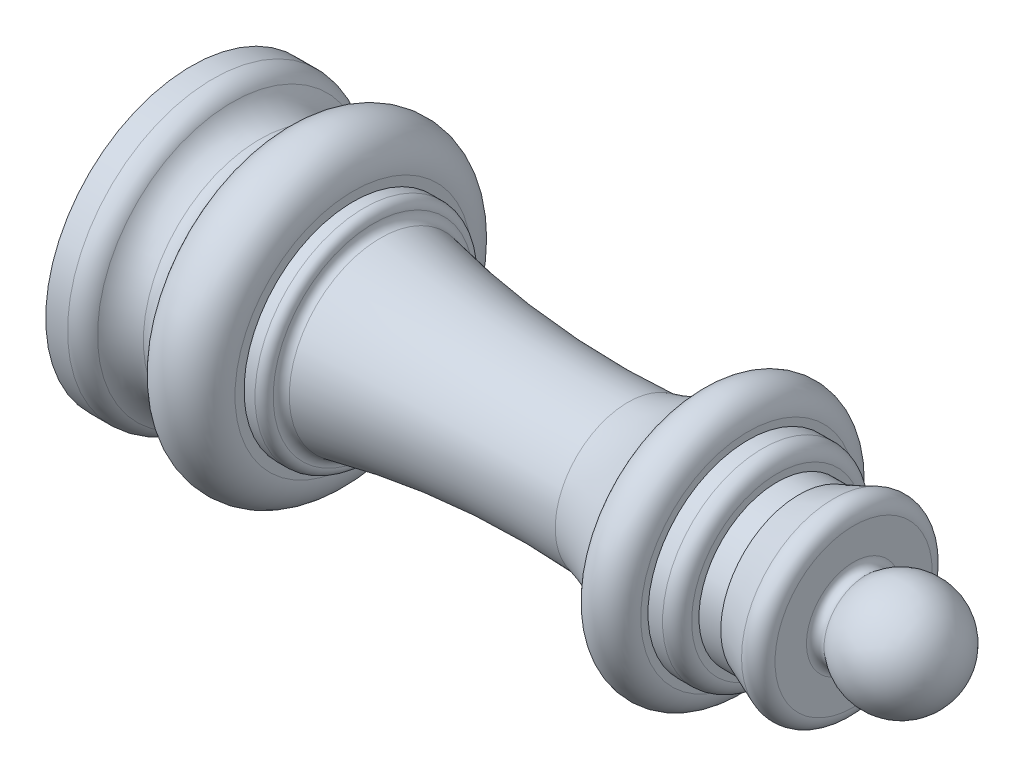
from build123d import *

# Parameters (mm, degrees)
FILLET_1_R = 2


with BuildPart() as part:
    # 草圖1 → 旋轉1 (revolve)
    with BuildSketch(Plane.XY):
        with BuildLine():
            Line((-14.008781327, 6.473278017), (-14.008781327, 13.75))
            Line((-14.008781327, 13.75), (-21.508781327, 10.75))
            Line((-21.508781327, 10.75), (-24.508781327, 10.75))
            Line((-24.508781327, 10.75), (-24.508781327, 13.75))
            Line((-24.508781327, 13.75), (-28.508781327, 13.75))
            Line((-28.508781327, 13.75), (-28.508781327, 14.75))
            ThreePointArc((-28.508781327, 14.75), (-32.125077777, 18), (-35.5, 14.5))
            ThreePointArc((-35.5, 14.5), (-40.005812785, 11.734493658), (-45, 10))
            ThreePointArc((-45, 10), (-62.092533005, 10.09842212), (-79.01183648, 12.527730939))
            ThreePointArc((-79.01183648, 12.527730939), (-79.722058533, 12.964123287), (-80, 13.749999986))
            ThreePointArc((-80, 13.749999986), (-80.366116517, 14.633883442), (-81.249999967, 15))
            Line((-81.249999967, 15), (-82.749999967, 15))
            Line((-82.749999967, 15), (-82.749999967, 16.25))
            ThreePointArc((-82.749999967, 16.25), (-86.882831697, 21.174227776), (-92.449207629, 17.958053628))
            ThreePointArc((-92.449207629, 17.958053628), (-93.681151081, 16.437382693), (-95.588720523, 16))
            ThreePointArc((-95.588720523, 16), (-97.791710555, 16.786665495), (-99.39577759, 18.489303625))
            ThreePointArc((-99.39577759, 18.489303625), (-100.494661353, 19.594986564), (-102, 20))
            Line((-102, 20), (-105, 20))
            Line((-105, 20), (-105, 0))
            Line((-105, 0), (0, 0))
            ThreePointArc((0, 0), (-4.353984309, 6.808273296), (-12.360689406, 5.711715898))
            ThreePointArc((-12.360689406, 5.711715898), (-13.428250086, 5.565508245), (-14.008781327, 6.473278017))
        make_face()
    revolve(axis=Axis((0, 0, 0), (-1, 0, 0)))

    # 草圖1<3> → 旋轉3 (revolve)
    with BuildSketch(Plane.XY):
        with BuildLine():
            Line((-14.008781327, 6.473278017), (-14.008781327, 13.75))
            Line((-14.008781327, 13.75), (-21.508781327, 10.75))
            Line((-21.508781327, 10.75), (-24.508781327, 10.75))
            Line((-24.508781327, 10.75), (-24.508781327, 13.75))
            Line((-24.508781327, 13.75), (-28.508781327, 13.75))
            Line((-28.508781327, 13.75), (-28.508781327, 14.75))
            ThreePointArc((-28.508781327, 14.75), (-32.125077777, 18), (-35.5, 14.5))
            ThreePointArc((-35.5, 14.5), (-40.005812785, 11.734493658), (-45, 10))
            ThreePointArc((-45, 10), (-62.092533005, 10.09842212), (-79.01183648, 12.527730939))
            ThreePointArc((-79.01183648, 12.527730939), (-79.722058533, 12.964123287), (-80, 13.749999986))
            ThreePointArc((-80, 13.749999986), (-80.366116517, 14.633883442), (-81.249999967, 15))
            Line((-81.249999967, 15), (-82.749999967, 15))
            Line((-82.749999967, 15), (-82.749999967, 16.25))
            ThreePointArc((-82.749999967, 16.25), (-86.882831697, 21.174227776), (-92.449207629, 17.958053628))
            ThreePointArc((-92.449207629, 17.958053628), (-93.681151081, 16.437382693), (-95.588720523, 16))
            ThreePointArc((-95.588720523, 16), (-97.791710555, 16.786665495), (-99.39577759, 18.489303625))
            ThreePointArc((-99.39577759, 18.489303625), (-100.494661353, 19.594986564), (-102, 20))
            Line((-102, 20), (-105, 20))
            Line((-105, 20), (-105, 0))
            Line((-105, 0), (0, 0))
            ThreePointArc((0, 0), (-4.353984309, 6.808273296), (-12.360689406, 5.711715898))
            ThreePointArc((-12.360689406, 5.711715898), (-13.428250086, 5.565508245), (-14.008781327, 6.473278017))
        make_face()
    revolve(axis=Axis((0, 0, 0), (-1, 0, 0)))

    # 圓角1
    fillet_1_edges = [part.edges().sort_by_distance(p)[0] for p in [
        (-24.508781327, -13.75, 0),
        (-14.008781327, -13.75, 0),
        (-35.5, -14.5, 0),
    ]]
    fillet(fillet_1_edges, radius=FILLET_1_R)


solid = part.part
